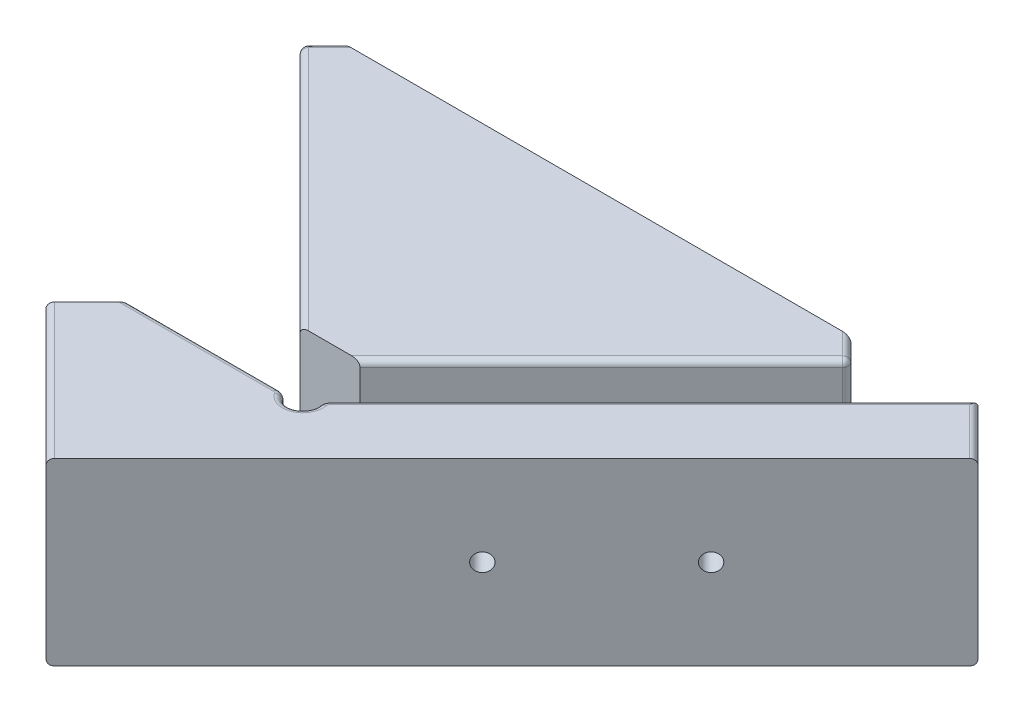
from build123d import *

# Parameters (mm, degrees)
BOSS_EXTRUDE1_DEPTH = 15
CUT_EXTRUDE5_REACH  = 43.908
SKETCH9_R           = 2
CUT_EXTRUDE6_REACH  = 43.908
SKETCH10_R          = 2
CUT_EXTRUDE7_REACH  = 40.079
FILLET1_R           = 0.5
CUT_EXTRUDE8_REACH  = 39.141
SKETCH11_R          = 3.5
CUT_EXTRUDE9_REACH  = 39.141
SKETCH12_R          = 3.5
SKETCH14_W          = 55
SKETCH14_H          = 15
SKETCH14_R          = 0.75
BOSS_EXTRUDE2_DEPTH = 6
BOSS_EXTRUDE3_DEPTH = 15
CUT_EXTRUDE10_DEPTH = 15
FILLET2_R           = 0.5


with BuildPart() as part:
    # Sketch1 → Boss-Extrude1 (new body)
    with BuildSketch(Plane(origin=(0, 0, 0), x_dir=(1, 0, 0), z_dir=(0, 1, 0))):
        Polygon((-24.748737342, 0), (24.748737342, 0), (0, -24.748737342), align=None)
    extrude(amount=BOSS_EXTRUDE1_DEPTH)

    # Cut-Extrude5: up to this plane
    cut_extrude5_end = Plane(origin=(-24.748737342, 15, 0), z_dir=(0, 0, 1))
    # Sketch9 → Cut-Extrude5 (cut, up to the surface)
    with BuildSketch(Plane(origin=(12.374368671, 0, 12.374368671), x_dir=(0.7071067811865474, 0, -0.7071067811865477), z_dir=(0.7071067811865477, 0, 0.7071067811865474)), mode=Mode.PRIVATE) as cut_extrude5_sk1:
        with Locations((-6.75, 7.5)):
            Circle(SKETCH9_R)
    cut_extrude5_tool1 = split(extrude(cut_extrude5_sk1.sketch, amount=-CUT_EXTRUDE5_REACH, mode=Mode.PRIVATE), bisect_by=cut_extrude5_end, keep=Keep.BOTH, mode=Mode.PRIVATE)
    add(cut_extrude5_tool1.solids().sort_by_distance((7.601398, 7.5, 17.147339))[0], mode=Mode.SUBTRACT)
    # Sketch9 → Cut-Extrude5 (cut, up to the surface)
    with BuildSketch(Plane(origin=(12.374368671, 0, 12.374368671), x_dir=(0.7071067811865474, 0, -0.7071067811865477), z_dir=(0.7071067811865477, 0, 0.7071067811865474)), mode=Mode.PRIVATE) as cut_extrude5_sk2:
        with Locations((6.75, 7.5)):
            Circle(SKETCH9_R)
    cut_extrude5_tool2 = split(extrude(cut_extrude5_sk2.sketch, amount=-CUT_EXTRUDE5_REACH, mode=Mode.PRIVATE), bisect_by=cut_extrude5_end, keep=Keep.BOTH, mode=Mode.PRIVATE)
    add(cut_extrude5_tool2.solids().sort_by_distance((17.147339, 7.5, 7.601398))[0], mode=Mode.SUBTRACT)

    # Cut-Extrude6: up to this plane
    cut_extrude6_end = Plane(origin=(-24.748737342, 15, 0), z_dir=(0, 0, 1))
    # Sketch10 → Cut-Extrude6 (cut, up to the surface)
    with BuildSketch(Plane(origin=(-12.374368671, 0, 12.374368671), x_dir=(0.7071067811865472, 0, 0.7071067811865479), z_dir=(-0.7071067811865479, 0, 0.7071067811865472)), mode=Mode.PRIVATE) as cut_extrude6_sk1:
        with Locations((-6.75, 7.5)):
            Circle(SKETCH10_R)
    cut_extrude6_tool1 = split(extrude(cut_extrude6_sk1.sketch, amount=-CUT_EXTRUDE6_REACH, mode=Mode.PRIVATE), bisect_by=cut_extrude6_end, keep=Keep.BOTH, mode=Mode.PRIVATE)
    add(cut_extrude6_tool1.solids().sort_by_distance((-17.147339, 7.5, 7.601398))[0], mode=Mode.SUBTRACT)
    # Sketch10 → Cut-Extrude6 (cut, up to the surface)
    with BuildSketch(Plane(origin=(-12.374368671, 0, 12.374368671), x_dir=(0.7071067811865472, 0, 0.7071067811865479), z_dir=(-0.7071067811865479, 0, 0.7071067811865472)), mode=Mode.PRIVATE) as cut_extrude6_sk2:
        with Locations(Location((6.75, 7.5, 0), (0, 0, 90))):
            Circle(SKETCH10_R)
    cut_extrude6_tool2 = split(extrude(cut_extrude6_sk2.sketch, amount=-CUT_EXTRUDE6_REACH, mode=Mode.PRIVATE), bisect_by=cut_extrude6_end, keep=Keep.BOTH, mode=Mode.PRIVATE)
    add(cut_extrude6_tool2.solids().sort_by_distance((-7.601398, 7.5, 17.147339))[0], mode=Mode.SUBTRACT)

    # Sketch3 → Cut-Extrude7 (cut, up to next)
    with BuildSketch(Plane.XZ, mode=Mode.PRIVATE) as cut_extrude7_sk1:
        Polygon((-2.5, 22.248737342), (0, 24.748737342), (2.5, 22.248737342), align=None)
    cut_extrude7_tool1 = extrude(cut_extrude7_sk1.sketch, amount=-CUT_EXTRUDE7_REACH, mode=Mode.PRIVATE) & part.part
    # Sketch3 → Cut-Extrude7 (cut, up to next)
    with BuildSketch(Plane.XZ, mode=Mode.PRIVATE) as cut_extrude7_sk2:
        Polygon((-24.748737342, 0), (-22.980970389, 1.767766953), (-21.213203436, 0), align=None)
    cut_extrude7_tool2 = extrude(cut_extrude7_sk2.sketch, amount=-CUT_EXTRUDE7_REACH, mode=Mode.PRIVATE) & part.part
    # Sketch3 → Cut-Extrude7 (cut, up to next)
    with BuildSketch(Plane.XZ, mode=Mode.PRIVATE) as cut_extrude7_sk3:
        Polygon((24.748737342, 0), (21.213203436, 0), (22.980970389, 1.767766953), align=None)
    cut_extrude7_tool3 = extrude(cut_extrude7_sk3.sketch, amount=-CUT_EXTRUDE7_REACH, mode=Mode.PRIVATE) & part.part
    add(cut_extrude7_tool1.solids().sort_by_distance((0, 0, 23.082071))[0], mode=Mode.SUBTRACT)
    add(cut_extrude7_tool2.solids().sort_by_distance((-22.98097, 0, 0.589256))[0], mode=Mode.SUBTRACT)
    add(cut_extrude7_tool3.solids().sort_by_distance((22.98097, 0, 0.589256))[0], mode=Mode.SUBTRACT)

    # Fillet1
    fillet1_edges = [part.edges().sort_by_distance(p)[0] for p in [
        (-12.740485194, 0, 12.008252147),
        (12.740485194, 0, 12.008252147),
        (-12.740485194, 15, 12.008252147),
        (12.740485194, 15, 12.008252147),
        (22.980970389, 7.5, 1.767766953),
        (22.097086912, 15, 0.883883476),
        (22.097086912, 0, 0.883883476),
        (-22.097086912, 15, 0.883883476),
        (-22.980970389, 7.5, 1.767766953),
        (-22.097086912, 0, 0.883883476),
    ]]
    fillet(fillet1_edges, radius=FILLET1_R)

    # Cut-Extrude8: up to this plane
    cut_extrude8_end = Plane(origin=(-24.748737342, 15, 0), z_dir=(0, 0, 1))
    # Sketch11 → Cut-Extrude8 (cut, up to the surface)
    with BuildSketch(Plane(origin=(-8.131727984, 0, 8.131727984), x_dir=(0.7071067811865475, 0, 0.7071067811865477), z_dir=(-0.7071067811865477, 0, 0.7071067811865475)), mode=Mode.PRIVATE) as cut_extrude8_sk1:
        with Locations((-6.75, 7.5)):
            Circle(SKETCH11_R)
    cut_extrude8_tool1 = split(extrude(cut_extrude8_sk1.sketch, amount=-CUT_EXTRUDE8_REACH, mode=Mode.PRIVATE), bisect_by=cut_extrude8_end, keep=Keep.BOTH, mode=Mode.PRIVATE)
    add(cut_extrude8_tool1.solids().sort_by_distance((-12.904699, 7.5, 3.358757))[0], mode=Mode.SUBTRACT)
    # Sketch11 → Cut-Extrude8 (cut, up to the surface)
    with BuildSketch(Plane(origin=(-8.131727984, 0, 8.131727984), x_dir=(0.7071067811865475, 0, 0.7071067811865477), z_dir=(-0.7071067811865477, 0, 0.7071067811865475)), mode=Mode.PRIVATE) as cut_extrude8_sk2:
        with Locations((6.75, 7.5)):
            Circle(SKETCH11_R)
    cut_extrude8_tool2 = split(extrude(cut_extrude8_sk2.sketch, amount=-CUT_EXTRUDE8_REACH, mode=Mode.PRIVATE), bisect_by=cut_extrude8_end, keep=Keep.BOTH, mode=Mode.PRIVATE)
    add(cut_extrude8_tool2.solids().sort_by_distance((-3.358757, 7.5, 12.904699))[0], mode=Mode.SUBTRACT)

    # Cut-Extrude9: up to this plane
    cut_extrude9_end = Plane(origin=(-24.748737342, 15, 0), z_dir=(0, 0, 1))
    # Sketch12 → Cut-Extrude9 (cut, up to the surface)
    with BuildSketch(Plane(origin=(8.131727984, 0, 8.131727984), x_dir=(0.7071067811865474, 0, -0.7071067811865477), z_dir=(0.7071067811865477, 0, 0.7071067811865474)), mode=Mode.PRIVATE) as cut_extrude9_sk1:
        with Locations((6.75, 7.5)):
            Circle(SKETCH12_R)
    cut_extrude9_tool1 = split(extrude(cut_extrude9_sk1.sketch, amount=-CUT_EXTRUDE9_REACH, mode=Mode.PRIVATE), bisect_by=cut_extrude9_end, keep=Keep.BOTH, mode=Mode.PRIVATE)
    add(cut_extrude9_tool1.solids().sort_by_distance((12.904699, 7.5, 3.358757))[0], mode=Mode.SUBTRACT)
    # Sketch12 → Cut-Extrude9 (cut, up to the surface)
    with BuildSketch(Plane(origin=(8.131727984, 0, 8.131727984), x_dir=(0.7071067811865474, 0, -0.7071067811865477), z_dir=(0.7071067811865477, 0, 0.7071067811865474)), mode=Mode.PRIVATE) as cut_extrude9_sk2:
        with Locations(Location((-6.75, 7.5, 0), (0, 0, 90))):
            Circle(SKETCH12_R)
    cut_extrude9_tool2 = split(extrude(cut_extrude9_sk2.sketch, amount=-CUT_EXTRUDE9_REACH, mode=Mode.PRIVATE), bisect_by=cut_extrude9_end, keep=Keep.BOTH, mode=Mode.PRIVATE)
    add(cut_extrude9_tool2.solids().sort_by_distance((3.358757, 7.5, 12.904699))[0], mode=Mode.SUBTRACT)


with BuildPart() as body_2:
    # Sketch14 → Boss-Extrude2 (new body)
    with BuildSketch(Plane(origin=(19.445436483, 0, 19.445436483), x_dir=(0.7071067811865474, 0, -0.7071067811865477), z_dir=(0.7071067811865477, 0, 0.7071067811865474))):
        with Locations((-5, 7.5)):
            Rectangle(SKETCH14_W, SKETCH14_H)
        with Locations((-6.75, 7.5)):
            Circle(SKETCH14_R, mode=Mode.SUBTRACT)
        with Locations((6.75, 7.5)):
            Circle(SKETCH14_R, mode=Mode.SUBTRACT)
    extrude(amount=-BOSS_EXTRUDE2_DEPTH)

    # Sketch15 → Boss-Extrude3 (add)
    with BuildSketch(Plane(origin=(0, 15, 0), x_dir=(1, 0, 0), z_dir=(0, 1, 0))):
        Polygon((-7.778174593, -38.183766184), (2.828427125, -27.577164466), (-11.313708499, -27.577164466), (-14.849242405, -31.112698372), align=None)
    extrude(amount=-BOSS_EXTRUDE3_DEPTH)

    # Sketch16 → Cut-Extrude10 (cut)
    with BuildSketch(Plane(origin=(0, 15, 0), x_dir=(1, 0, 0), z_dir=(0, 1, 0))):
        with BuildLine():
            Line((1.078762465, -27.577164466), (2.828427125, -27.577164466))
            Line((2.828427125, -27.577164466), (4.065626871, -26.33996472))
            ThreePointArc((4.065626871, -26.33996472), (3.880745387, -26.644524103), (3.857263416, -27.00003244))
            ThreePointArc((3.857263416, -27.00003244), (3.134573871, -28.316268092), (1.692836037, -27.896567615))
            ThreePointArc((1.692836037, -27.896567615), (1.42484942, -27.66178952), (1.078762465, -27.577164466))
        make_face()
    extrude(amount=-CUT_EXTRUDE10_DEPTH, mode=Mode.SUBTRACT)

    # Fillet2
    fillet2_edges = [body_2.edges().sort_by_distance(p)[0] for p in [
        (17.589162621, 15, 12.81642897),
        (-5.117473017, 0, 27.577164466),
        (-5.117473017, 15, 27.577164466),
        (17.589162621, 0, 12.81642897),
        (3.880745387, 15, 26.644524103),
        (1.42484942, 15, 27.66178952),
        (3.134573871, 15, 28.316268092),
        (1.42484942, 0, 27.66178952),
        (3.134573871, 0, 28.316268092),
        (3.880745387, 0, 26.644524103),
        (-9.192388155, 15, 36.769552622),
        (33.234018716, 15, 1.414213562),
        (33.234018716, 0, 1.414213562),
        (-9.192388155, 0, 36.769552622),
    ]]
    fillet(fillet2_edges, radius=FILLET2_R)


solid = Compound([part.part, body_2.part])
